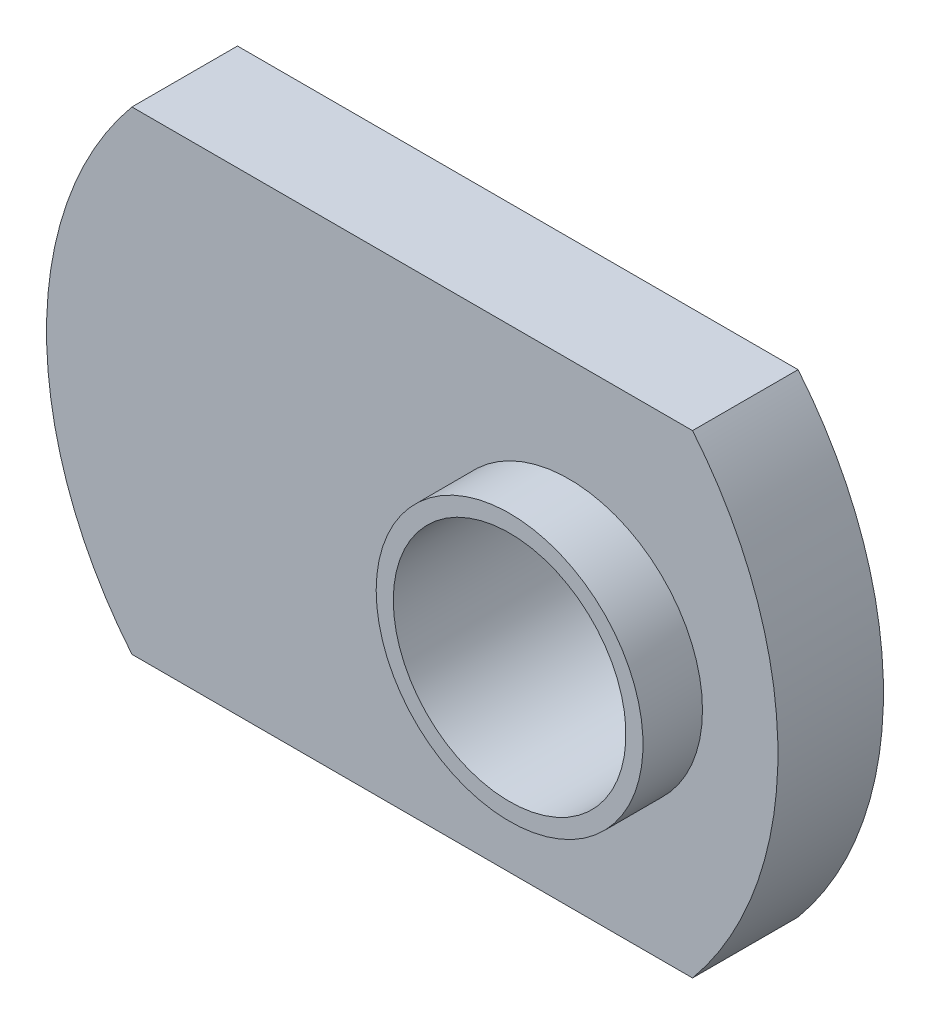
from build123d import *

# Parameters (mm, degrees)
BOSS_EXTRUDE1_DEPTH  = 3.6068
SKETCH2_W            = 4.5593
SKETCH2_H            = 2.032
M7_CLEARANCE_HOLE1_D = 7.9502


with BuildPart() as part:
    # Sketch1 → Boss-Extrude1 (new body)
    with BuildSketch(Plane.XY.offset(3.6068)):
        with BuildLine():
            Line((102.341394541, 120.371267572), (121.498125987, 120.371267572))
            ThreePointArc((121.498125987, 120.371267572), (124.416560264, 128.471327572), (121.498125987, 136.571387572))
            Line((121.498125987, 136.571387572), (102.341394541, 136.571387572))
            ThreePointArc((102.341394541, 136.571387572), (99.422960264, 128.471327572), (102.341394541, 120.371267572))
        make_face()
    extrude(amount=-BOSS_EXTRUDE1_DEPTH)

    # Sketch2 → Revolve1 (revolve)
    with BuildSketch(Plane.XZ.offset(-128.471327572), mode=Mode.PRIVATE) as revolve1_sk:
        with Locations((119.558810264, 4.6228)):
            Rectangle(SKETCH2_W, SKETCH2_H)
    revolve(revolve1_sk.sketch.rotate(Axis((117.279160264, 128.471327572, 5.6388), (0, 0, -1)), 180), axis=Axis((117.279160264, 128.471327572, 5.6388), (0, 0, -1)))

    # M7 Clearance Hole1 (through all)
    with Locations(Plane(origin=(0, 0, 0), x_dir=(-1, 0, 0), z_dir=(0, 0, -1))):
        with Locations((-117.279160264, 128.471327572)):
            Hole(M7_CLEARANCE_HOLE1_D / 2)


solid = part.part
